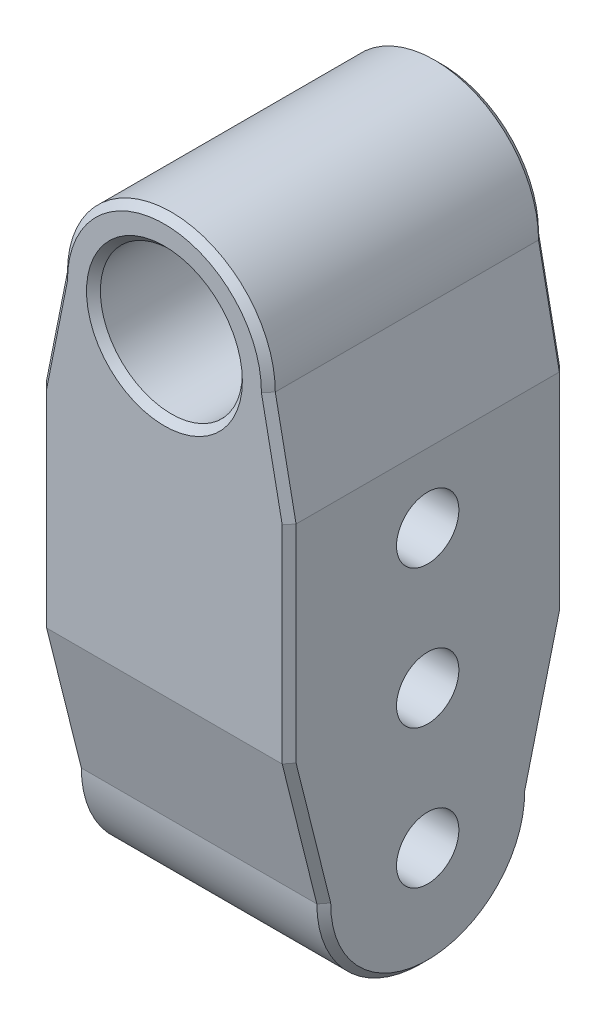
from build123d import *

# Parameters (mm, degrees)
SKETCH_1_R               = 10.25
EXTRUDE_1_DEPTH          = 20
SKETCH_2_R               = 4.5
CUT_EXTRUDE_1_DEPTH      = 20
CUT_EXTRUDE_2_DEPTH      = 90.977775034
CUT_EXTRUDE_2_DEPTH_BACK = 90.977775034
CHAMFER_1_SIZE           = 1


with BuildPart() as part:
    # 草图1 → 凸台-拉伸1 (new, symmetric)
    with BuildSketch(Plane.XY):
        with BuildLine():
            Line((0, -80), (18, -80))
            Line((18, -80), (18, -15))
            Line((18, -15), (15, 0))
            ThreePointArc((15, 0), (0, 15), (-15, 0))
            Line((-15, 0), (-18, -15))
            Line((-18, -15), (-18, -80))
            Line((-18, -80), (0, -80))
        make_face()
        Circle(SKETCH_1_R, mode=Mode.SUBTRACT)
    extrude(amount=EXTRUDE_1_DEPTH, both=True)

    # 草图2 → 切除-拉伸1 (cut, symmetric)
    with BuildSketch(Plane(origin=(0, 0, 0), x_dir=(0, 0, -1), z_dir=(1, 0, 0))):
        with Locations(Location((0, -45, 0), (0, 0, 90))):
            Circle(SKETCH_2_R)
        with Locations(Location((0, -25, 0), (0, 0, 90))):
            Circle(SKETCH_2_R)
        with Locations(Location((0, -65, 0), (0, 0, 90))):
            Circle(SKETCH_2_R)
    extrude(amount=CUT_EXTRUDE_1_DEPTH, both=True, mode=Mode.SUBTRACT)

    # 草图7 → 切除-拉伸2 (cut, two sides: drawn at the far end of the back side and taken through both)
    with BuildSketch(Plane(origin=(18, 0, 0), x_dir=(0, 0, -1), z_dir=(1, 0, 0)).offset(-CUT_EXTRUDE_2_DEPTH_BACK)):
        with BuildLine():
            Line((-15, -65), (-20, -45))
            Line((-20, -45), (-20, -80))
            Line((-20, -80), (1.38e-07, -80))
            ThreePointArc((1.38e-07, -80), (-10.606601669, -75.606601767), (-15, -65))
        make_face()
        with BuildLine():
            ThreePointArc((15, -65), (10.606601767, -75.606601669), (1.38e-07, -80))
            Line((1.38e-07, -80), (20, -80))
            Line((20, -80), (20, -45))
            Line((20, -45), (15, -65))
        make_face()
    extrude(amount=CUT_EXTRUDE_2_DEPTH + CUT_EXTRUDE_2_DEPTH_BACK, mode=Mode.SUBTRACT)

    # 倒角1
    chamfer_1_edges = [part.edges().sort_by_distance(p)[0] for p in [
        (16.5, -7.5, 20),
        (-10.25, 0, -20),
        (-10.25, 0, 20),
        (0, 15, 20),
        (-16.5, -7.5, 20),
        (-18, -30, 20),
        (-18, -55, -17.5),
        (-18, -80, 0),
        (-18, -55, 17.5),
        (18, -30, -20),
        (18, -30, 20),
        (18, -55, 17.5),
        (18, -80, 0),
        (18, -55, -17.5),
        (-18, -30, -20),
        (-16.5, -7.5, -20),
        (0, 15, -20),
        (16.5, -7.5, -20),
    ]]
    chamfer(chamfer_1_edges, length=CHAMFER_1_SIZE)


solid = part.part
